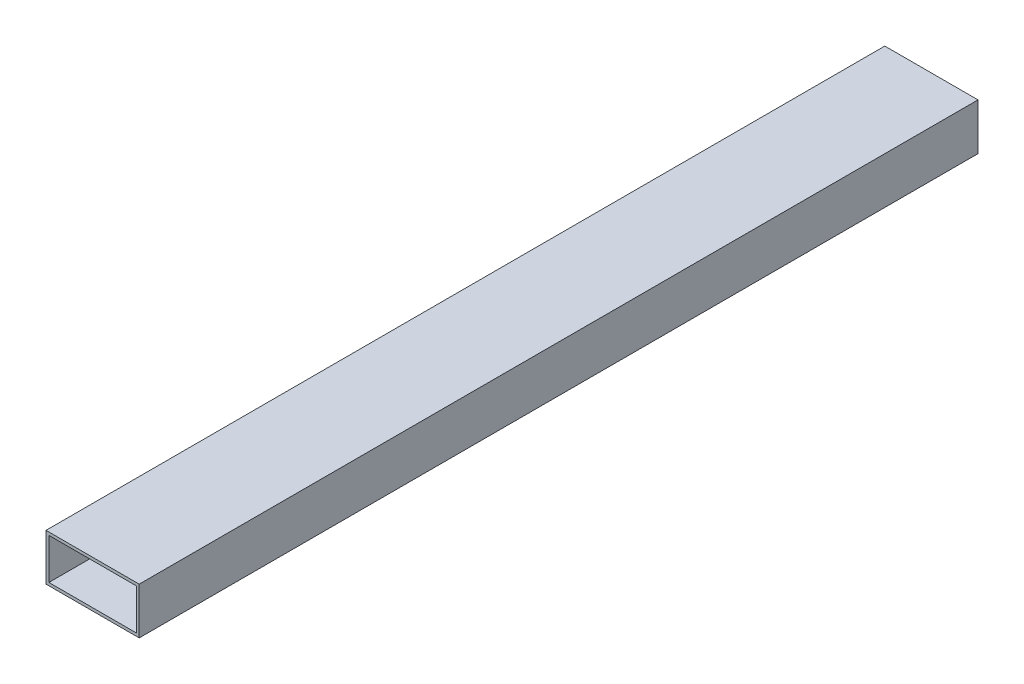
from build123d import *

# Parameters (mm, degrees)
BOSS_EXTRUDE1_DEPTH      = 228.6
BOSS_EXTRUDE1_DEPTH_BACK = 228.6
SKETCH3_W                = 50.8
SKETCH3_H                = 25.4
SKETCH3_W_2              = 47.625
SKETCH3_H_2              = 22.225


with BuildPart() as part:
    # Sketch3 → Boss-Extrude1 (new, two sides: drawn at the far end of the back side and taken through both)
    with BuildSketch(Plane.XY.offset(-BOSS_EXTRUDE1_DEPTH_BACK)):
        Rectangle(SKETCH3_W, SKETCH3_H)
        Rectangle(SKETCH3_W_2, SKETCH3_H_2, mode=Mode.SUBTRACT)
    extrude(amount=BOSS_EXTRUDE1_DEPTH + BOSS_EXTRUDE1_DEPTH_BACK)


solid = part.part
